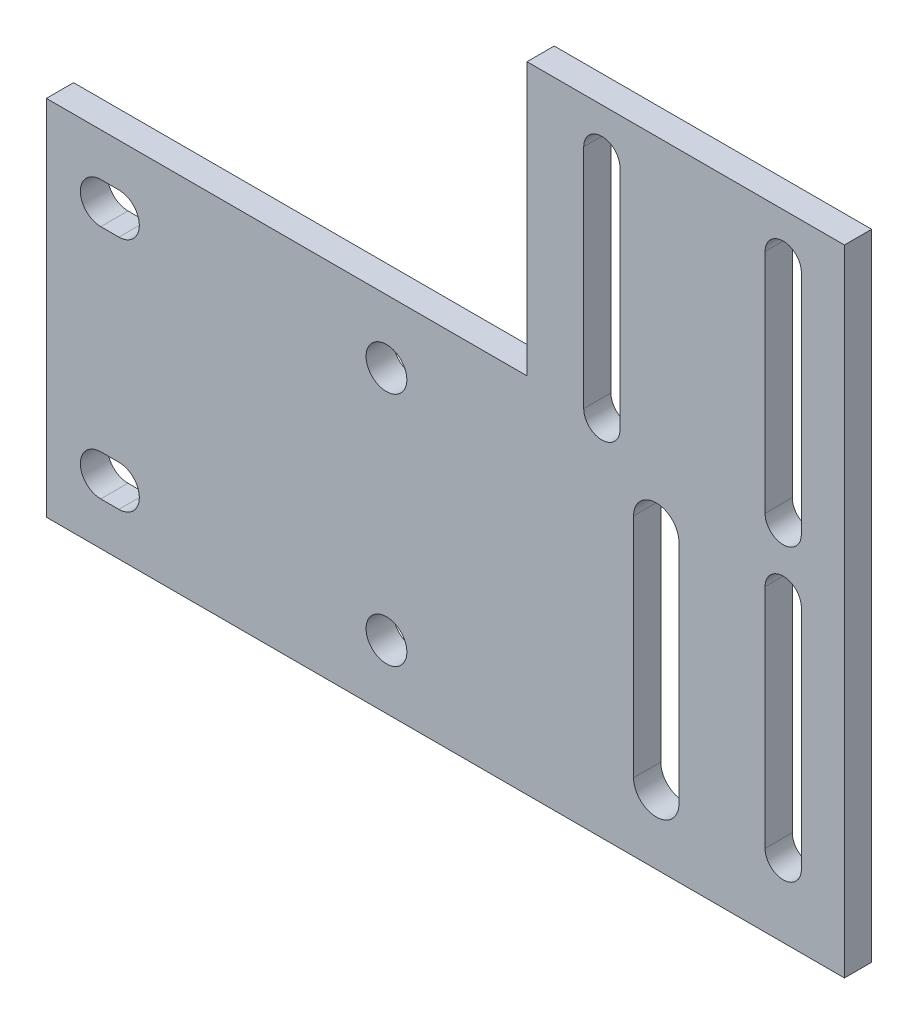
from build123d import *

# Parameters (mm, degrees)
SKETCH_1_R      = 2.25
EXTRUDE_1_DEPTH = 3


with BuildPart() as part:
    # 草图1 → 凸台-拉伸1 (new body)
    with BuildSketch(Plane.XY):
        Polygon((65.75, -20), (-22.25, -20), (-22.25, 20), (30.75, 20), (30.75, 50), (65.75, 50), (65.75, 20), align=None)
        with Locations((15.25, 13)):
            Circle(SKETCH_1_R, mode=Mode.SUBTRACT)
        with Locations((15.25, -13)):
            Circle(SKETCH_1_R, mode=Mode.SUBTRACT)
        with BuildLine():
            Line((-14.25, 10.75), (-16.25, 10.75))
            ThreePointArc((-16.25, 10.75), (-18.5, 13), (-16.25, 15.25))
            Line((-16.25, 15.25), (-14.25, 15.25))
            ThreePointArc((-14.25, 15.25), (-12, 13), (-14.25, 10.75))
        make_face(mode=Mode.SUBTRACT)
        with BuildLine():
            Line((-14.25, -15.25), (-16.25, -15.25))
            ThreePointArc((-16.25, -15.25), (-18.5, -13), (-16.25, -10.75))
            Line((-16.25, -10.75), (-14.25, -10.75))
            ThreePointArc((-14.25, -10.75), (-12, -13), (-14.25, -15.25))
        make_face(mode=Mode.SUBTRACT)
        with BuildLine():
            Line((42.5, -12.5), (42.5, 12.5))
            ThreePointArc((42.5, 12.5), (45, 15), (47.5, 12.5))
            Line((47.5, 12.5), (47.5, -12.5))
            ThreePointArc((47.5, -12.5), (45, -15), (42.5, -12.5))
        make_face(mode=Mode.SUBTRACT)
        with BuildLine():
            Line((57, 20), (57, 45))
            ThreePointArc((57, 45), (59, 47), (61, 45))
            Line((61, 45), (61, 20))
            ThreePointArc((61, 20), (59, 18), (57, 20))
        make_face(mode=Mode.SUBTRACT)
        with BuildLine():
            Line((61, -12), (61, 13))
            ThreePointArc((61, 13), (59, 15), (57, 13))
            Line((57, 13), (57, -12))
            ThreePointArc((57, -12), (59, -14), (61, -12))
        make_face(mode=Mode.SUBTRACT)
        with BuildLine():
            Line((41, 20), (41, 45))
            ThreePointArc((41, 45), (39, 47), (37, 45))
            Line((37, 45), (37, 20))
            ThreePointArc((37, 20), (39, 18), (41, 20))
        make_face(mode=Mode.SUBTRACT)
    extrude(amount=EXTRUDE_1_DEPTH)


solid = part.part
